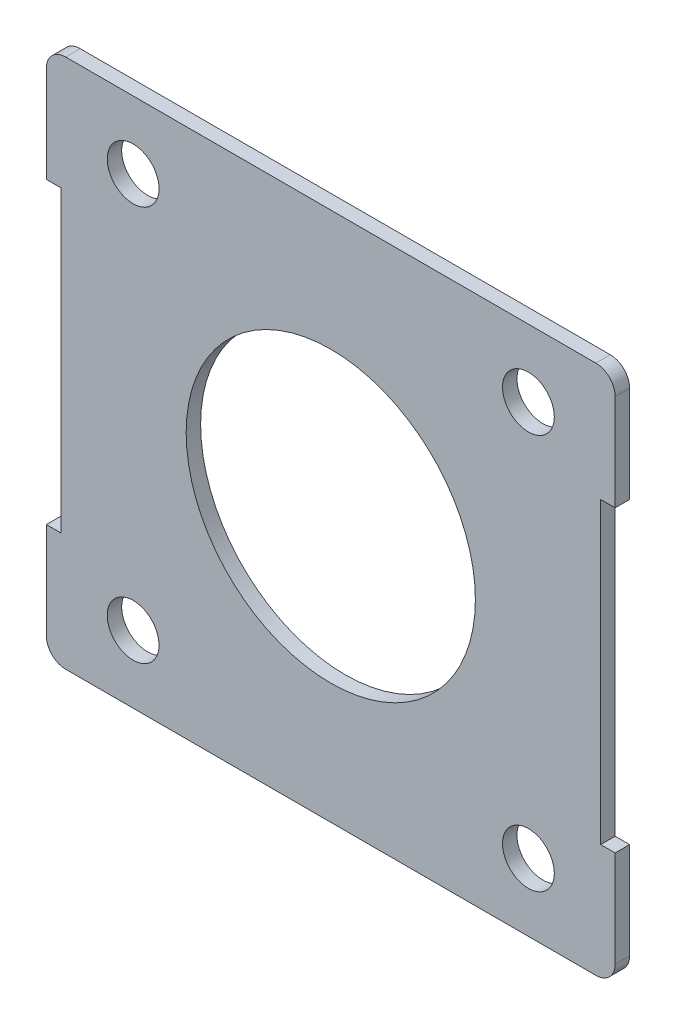
from build123d import *

# Parameters (mm, degrees)
SKETCH1_W          = 187.325
SKETCH1_H          = 174.625
EXTRUDE1_DEPTH     = 4.7625
CUT_EXTRUDE1_REACH = 130.136
SKETCH2_W          = 4.7625
SKETCH2_H          = 98.425
FILLET1_R          = 6.35
CUT_EXTRUDE2_REACH = 130.136
SKETCH3_R          = 47.625
SKETCH3_R_2        = 8.5328125


with BuildPart() as part:
    # Sketch1 → Extrude1 (new body)
    with BuildSketch(Plane.XY):
        Rectangle(SKETCH1_W, SKETCH1_H)
    extrude(amount=EXTRUDE1_DEPTH)

    # Sketch2 → Cut-Extrude1 (cut, up to next)
    with BuildSketch(Plane.XY.offset(4.7625), mode=Mode.PRIVATE) as cut_extrude1_sk1:
        with Locations((-91.28125, 0)):
            Rectangle(SKETCH2_W, SKETCH2_H)
    cut_extrude1_tool1 = extrude(cut_extrude1_sk1.sketch, amount=-CUT_EXTRUDE1_REACH, mode=Mode.PRIVATE) & part.part
    # Sketch2 → Cut-Extrude1 (cut, up to next)
    with BuildSketch(Plane.XY.offset(4.7625), mode=Mode.PRIVATE) as cut_extrude1_sk2:
        with Locations((91.28125, 0)):
            Rectangle(SKETCH2_W, SKETCH2_H)
    cut_extrude1_tool2 = extrude(cut_extrude1_sk2.sketch, amount=-CUT_EXTRUDE1_REACH, mode=Mode.PRIVATE) & part.part
    add(cut_extrude1_tool1.solids().sort_by_distance((-91.28125, 0, 4.7625))[0], mode=Mode.SUBTRACT)
    add(cut_extrude1_tool2.solids().sort_by_distance((91.28125, 0, 4.7625))[0], mode=Mode.SUBTRACT)

    # Fillet1
    fillet1_edges = [part.edges().sort_by_distance(p)[0] for p in [
        (-93.6625, 87.3125, 2.38125),
        (93.6625, 87.3125, 2.38125),
        (93.6625, -87.3125, 2.38125),
        (-93.6625, -87.3125, 2.38125),
    ]]
    fillet(fillet1_edges, radius=FILLET1_R)

    # Sketch3 → Cut-Extrude2 (cut, up to next)
    with BuildSketch(Plane.XY.offset(4.7625), mode=Mode.PRIVATE) as cut_extrude2_sk1:
        Circle(SKETCH3_R)
    cut_extrude2_tool1 = extrude(cut_extrude2_sk1.sketch, amount=-CUT_EXTRUDE2_REACH, mode=Mode.PRIVATE) & part.part
    # Sketch3 → Cut-Extrude2 (cut, up to next)
    with BuildSketch(Plane.XY.offset(4.7625), mode=Mode.PRIVATE) as cut_extrude2_sk2:
        with Locations((-65.0875, 65.0875)):
            Circle(SKETCH3_R_2)
    cut_extrude2_tool2 = extrude(cut_extrude2_sk2.sketch, amount=-CUT_EXTRUDE2_REACH, mode=Mode.PRIVATE) & part.part
    # Sketch3 → Cut-Extrude2 (cut, up to next)
    with BuildSketch(Plane.XY.offset(4.7625), mode=Mode.PRIVATE) as cut_extrude2_sk3:
        with Locations((-65.0875, -65.0875)):
            Circle(SKETCH3_R_2)
    cut_extrude2_tool3 = extrude(cut_extrude2_sk3.sketch, amount=-CUT_EXTRUDE2_REACH, mode=Mode.PRIVATE) & part.part
    # Sketch3 → Cut-Extrude2 (cut, up to next)
    with BuildSketch(Plane.XY.offset(4.7625), mode=Mode.PRIVATE) as cut_extrude2_sk4:
        with Locations((65.0875, -65.0875)):
            Circle(SKETCH3_R_2)
    cut_extrude2_tool4 = extrude(cut_extrude2_sk4.sketch, amount=-CUT_EXTRUDE2_REACH, mode=Mode.PRIVATE) & part.part
    # Sketch3 → Cut-Extrude2 (cut, up to next)
    with BuildSketch(Plane.XY.offset(4.7625), mode=Mode.PRIVATE) as cut_extrude2_sk5:
        with Locations((65.0875, 65.0875)):
            Circle(SKETCH3_R_2)
    cut_extrude2_tool5 = extrude(cut_extrude2_sk5.sketch, amount=-CUT_EXTRUDE2_REACH, mode=Mode.PRIVATE) & part.part
    add(cut_extrude2_tool1.solids().sort_by_distance((0, 0, 4.7625))[0], mode=Mode.SUBTRACT)
    add(cut_extrude2_tool2.solids().sort_by_distance((-65.0875, 65.0875, 4.7625))[0], mode=Mode.SUBTRACT)
    add(cut_extrude2_tool3.solids().sort_by_distance((-65.0875, -65.0875, 4.7625))[0], mode=Mode.SUBTRACT)
    add(cut_extrude2_tool4.solids().sort_by_distance((65.0875, -65.0875, 4.7625))[0], mode=Mode.SUBTRACT)
    add(cut_extrude2_tool5.solids().sort_by_distance((65.0875, 65.0875, 4.7625))[0], mode=Mode.SUBTRACT)


solid = part.part
